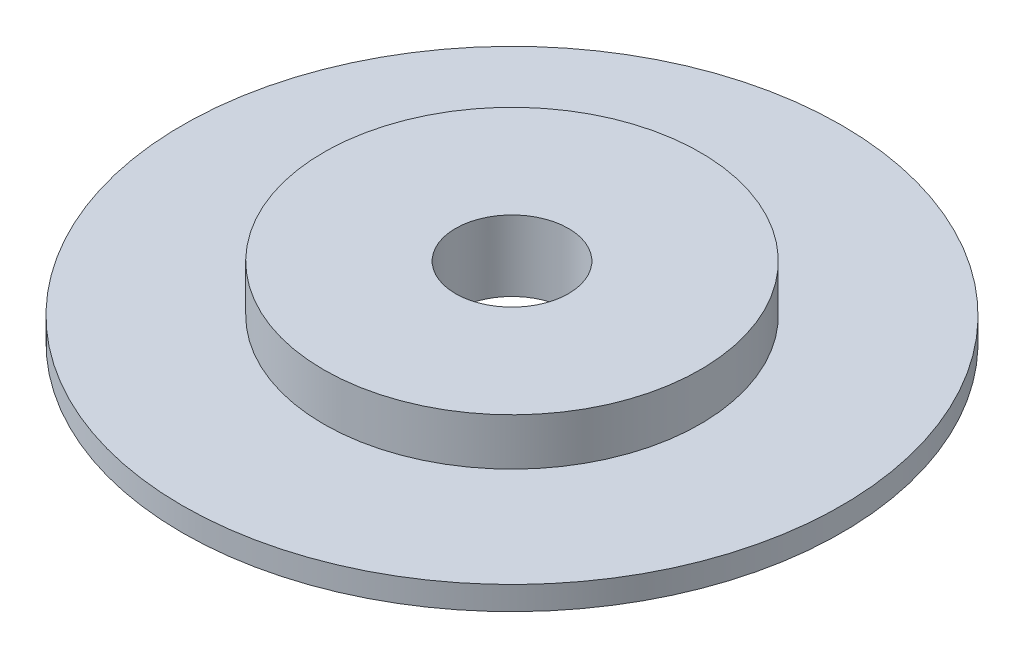
from build123d import *

# Parameters (mm, degrees)
SKETCH1_R                = 7
BOSS_EXTRUDE1_DEPTH      = 1.5
CUT_EXTRUDE1_START       = -1
SKETCH2_R                = 7
SKETCH2_R_2              = 4
CUT_EXTRUDE1_DEPTH       = 1
M2_CLEARANCE_HOLE1_D     = 2.4
M2_CLEARANCE_HOLE1_DEPTH = 3
M2_CLEARANCE_HOLE1_TIP   = 0.721032743


with BuildPart() as part:
    # Sketch1 → Boss-Extrude1 (new body)
    with BuildSketch(Plane(origin=(0, 0, 0), x_dir=(1, 0, 0), z_dir=(0, 1, 0))):
        with Locations(Location((0, 0, 0), (0, 0, 270))):
            Circle(SKETCH1_R)
    extrude(amount=BOSS_EXTRUDE1_DEPTH)

    # Sketch2 → Cut-Extrude1 (cut)
    with BuildSketch(Plane(origin=(0, 1.5, 0), x_dir=(1, 0, 0), z_dir=(0, 1, 0)).offset(CUT_EXTRUDE1_START)):
        with Locations(Location((0, 0, 0), (0, 0, 270))):
            Circle(SKETCH2_R)
        with Locations(Location((0, 0, 0), (0, 0, 270))):
            Circle(SKETCH2_R_2, mode=Mode.SUBTRACT)
    extrude(amount=CUT_EXTRUDE1_DEPTH, mode=Mode.SUBTRACT)

    # M2 Clearance Hole1
    with Locations(Plane(origin=(0, 0, 0), x_dir=(-1, 0, 0), z_dir=(0, -1, 0))):
        with Locations((0, 0)):
            Hole(M2_CLEARANCE_HOLE1_D / 2, depth=M2_CLEARANCE_HOLE1_DEPTH)
            with Locations((0, 0, -(M2_CLEARANCE_HOLE1_DEPTH + M2_CLEARANCE_HOLE1_TIP / 2))):  # 118° drill point
                Cone(0, M2_CLEARANCE_HOLE1_D / 2, M2_CLEARANCE_HOLE1_TIP, mode=Mode.SUBTRACT)


solid = part.part
